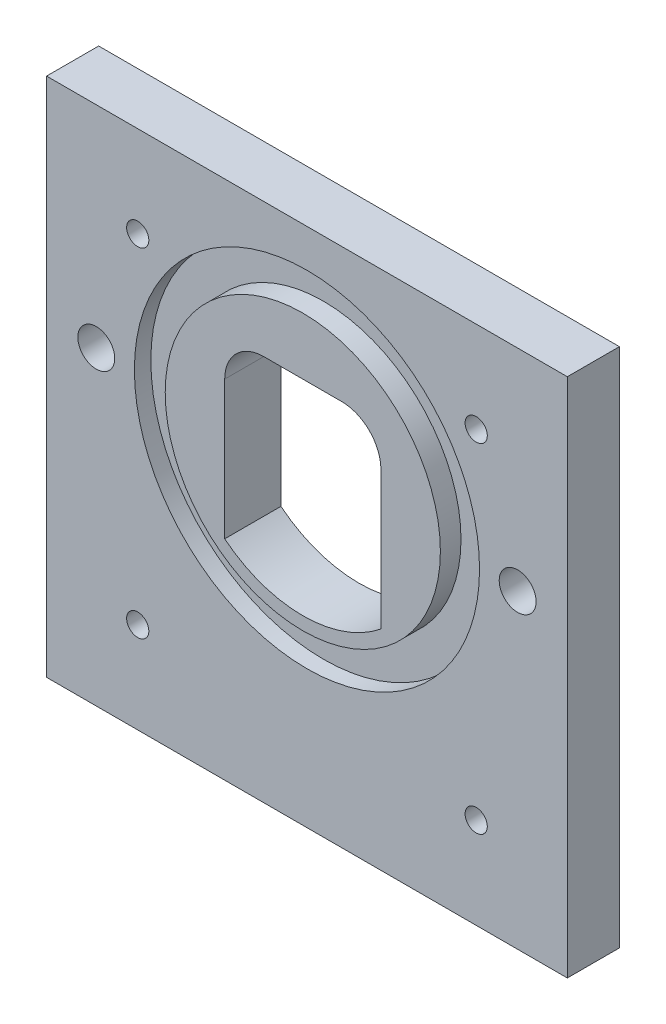
from build123d import *

# Parameters (mm, degrees)
SKETCH1_W                                       = 63.5
SKETCH1_H                                       = 63.5
BOSS_EXTRUDE1_DEPTH                             = 6.35
F_6_32_TAPPED_HOLE1_D                           = 2.7051
SKETCH4_R                                       = 21.0439
SKETCH4_R_2                                     = 16.7767
CUT_EXTRUDE1_DEPTH                              = 2.0066
BOSS_EXTRUDE2_START                             = 0.508
SKETCH5_R                                       = 16.7767
BOSS_EXTRUDE2_DEPTH                             = 0.508
CSK_FOR_M4_FLAT_HEAD_MACHINE_SCREW1_D           = 4.5
CSK_FOR_M4_FLAT_HEAD_MACHINE_SCREW1_CSINK_D     = 9.4
CSK_FOR_M4_FLAT_HEAD_MACHINE_SCREW1_CSINK_ANGLE = 90
CUT_EXTRUDE2_DEPTH                              = 46.421989873


with BuildPart() as part:
    # Sketch1 → Boss-Extrude1 (new body)
    with BuildSketch(Plane.XY):
        Rectangle(SKETCH1_W, SKETCH1_H)
    extrude(amount=BOSS_EXTRUDE1_DEPTH)

    # #6-32 Tapped Hole1 (through all)
    with Locations(Plane(origin=(0, 0, 0), x_dir=(-1, 0, 0), z_dir=(0, 0, -1))):
        with Locations((20.6375, -20.6375), (-20.6375, -20.6375), (-20.6375, 20.6375), (20.6375, 20.6375)):
            Hole(F_6_32_TAPPED_HOLE1_D / 2)

    # Sketch4 → Cut-Extrude1 (cut)
    with BuildSketch(Plane.XY.offset(6.35)):
        with Locations((0, 6.076865153)):
            Circle(SKETCH4_R)
        with Locations((0, 6.076865153)):
            Circle(SKETCH4_R_2, mode=Mode.SUBTRACT)
    extrude(amount=-CUT_EXTRUDE1_DEPTH, mode=Mode.SUBTRACT)

    # Sketch5 → Boss-Extrude2 (add)
    with BuildSketch(Plane.XY.offset(6.35).offset(BOSS_EXTRUDE2_START)):
        with Locations((0, 6.076865153)):
            Circle(SKETCH5_R)
    extrude(amount=-BOSS_EXTRUDE2_DEPTH)

    # CSK for M4 Flat Head Machine Screw1 (through all)
    with Locations(Plane(origin=(0, 0, 0), x_dir=(-1, 0, 0), z_dir=(0, 0, -1))):
        with Locations((-25.691176831, 6.076865153), (25.691176831, 6.076865153)):
            CounterSinkHole(CSK_FOR_M4_FLAT_HEAD_MACHINE_SCREW1_D / 2, CSK_FOR_M4_FLAT_HEAD_MACHINE_SCREW1_CSINK_D / 2, counter_sink_angle=CSK_FOR_M4_FLAT_HEAD_MACHINE_SCREW1_CSINK_ANGLE)

    # Sketch9 → Cut-Extrude2 (cut, through all)
    with BuildSketch(Plane(origin=(0, 0, 0), x_dir=(-1, 0, 0), z_dir=(0, 0, -1))):
        with BuildLine():
            Line((9.525, 11.1125), (9.525, -5.754710044))
            ThreePointArc((9.525, -5.754710044), (0, -9.112334847), (-9.525, -5.754710044))
            Line((-9.525, -5.754710044), (-9.525, 11.1125))
            ThreePointArc((-9.525, 11.1125), (-8.130096045, 14.480096045), (-4.7625, 15.875))
            Line((-4.7625, 15.875), (4.7625, 15.875))
            ThreePointArc((4.7625, 15.875), (8.130096045, 14.480096045), (9.525, 11.1125))
        make_face()
    extrude(amount=-CUT_EXTRUDE2_DEPTH, mode=Mode.SUBTRACT)


solid = part.part
